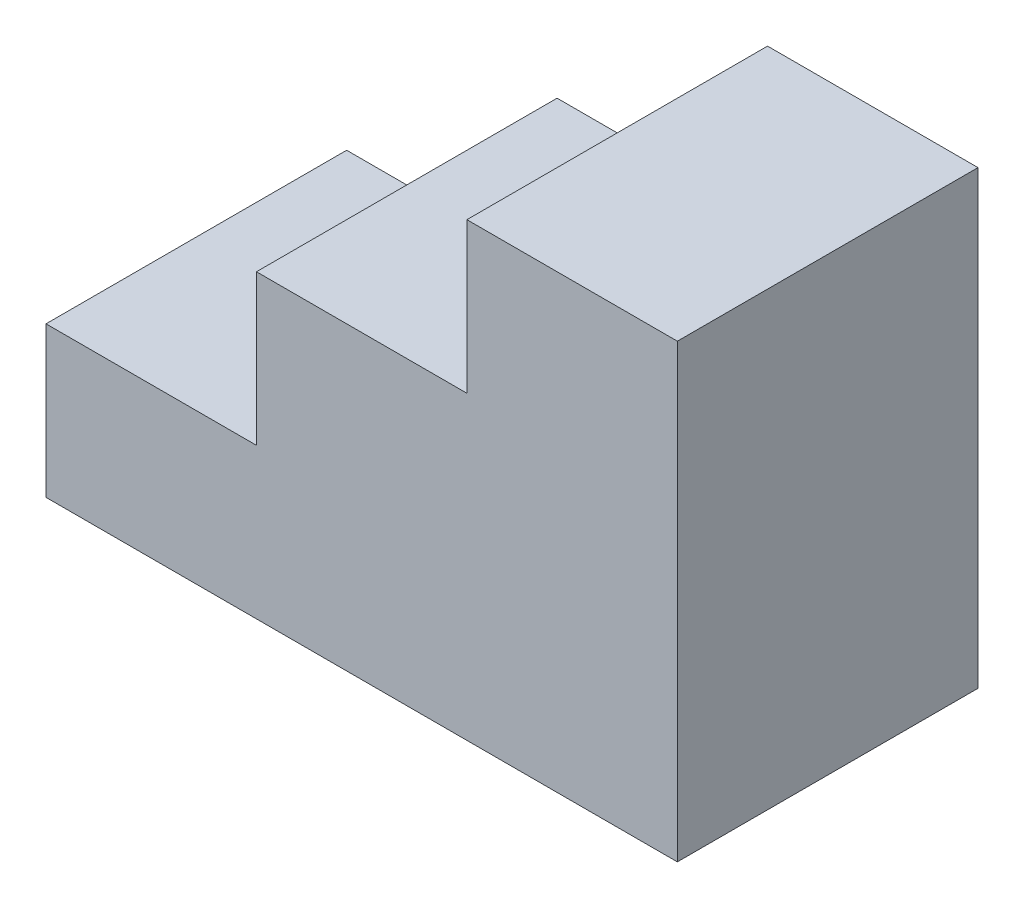
from build123d import *

# Parameters (mm, degrees)
BOSS_EXTRUDE1_DEPTH = 50


with BuildPart() as part:
    # Sketch1 → Boss-Extrude1 (new body)
    with BuildSketch(Plane.XY):
        Polygon((0, 0), (105, 0), (105, 75), (70, 75), (70, 50), (35, 50), (35, 25), (0, 25), align=None)
    extrude(amount=BOSS_EXTRUDE1_DEPTH)


solid = part.part
